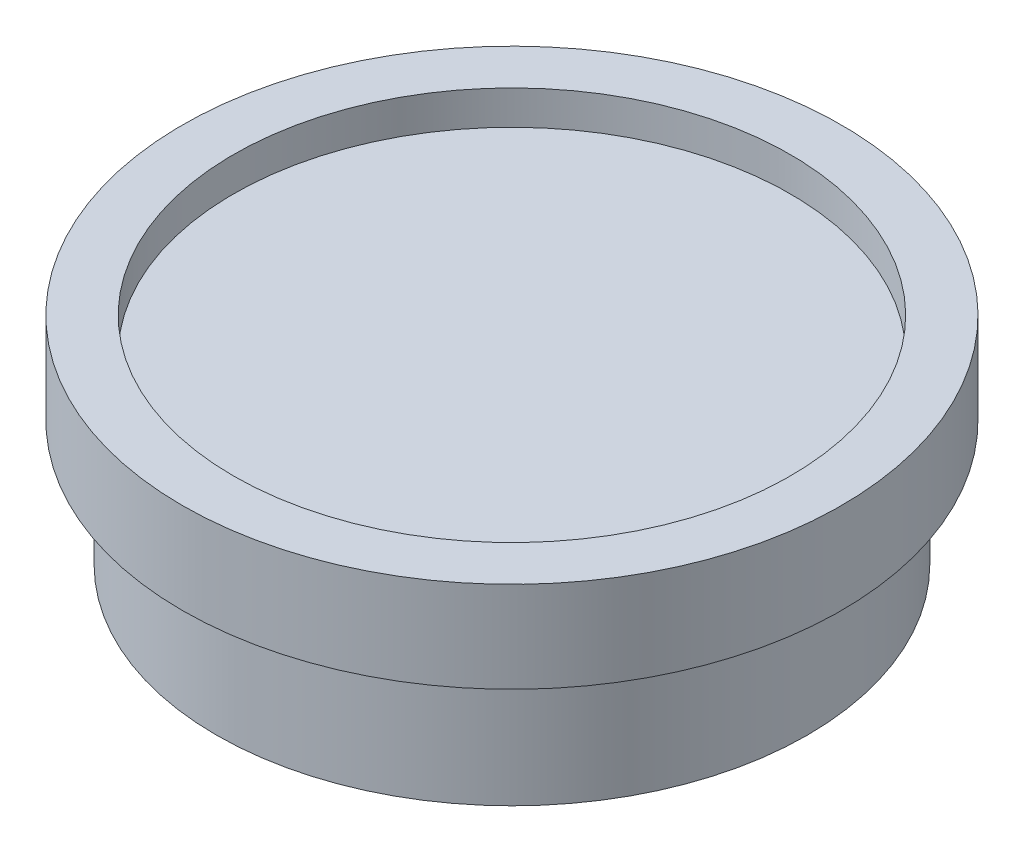
from build123d import *

# Parameters (mm, degrees)
SKETCH1_R           = 29
BOSS_EXTRUDE1_DEPTH = 8
SKETCH2_R           = 26
BOSS_EXTRUDE2_DEPTH = 11
SKETCH3_R           = 24.5
CUT_EXTRUDE1_DEPTH  = 3


with BuildPart() as part:
    # Sketch1 → Boss-Extrude1 (new body)
    with BuildSketch(Plane(origin=(0, 0, 0), x_dir=(1, 0, 0), z_dir=(0, 1, 0))):
        with Locations(Location((0, 0, 0), (0, 0, 270))):
            Circle(SKETCH1_R)
    extrude(amount=-BOSS_EXTRUDE1_DEPTH)

    # Sketch2 → Boss-Extrude2 (add)
    with BuildSketch(Plane.XZ.offset(8)):
        with Locations(Location((0, 0, 0), (0, 0, 90))):
            Circle(SKETCH2_R)
    extrude(amount=BOSS_EXTRUDE2_DEPTH)

    # Sketch3 → Cut-Extrude1 (cut)
    with BuildSketch(Plane(origin=(0, 0, 0), x_dir=(1, 0, 0), z_dir=(0, 1, 0))):
        with Locations(Location((0, 0, 0), (0, 0, 270))):
            Circle(SKETCH3_R)
    extrude(amount=-CUT_EXTRUDE1_DEPTH, mode=Mode.SUBTRACT)


solid = part.part
